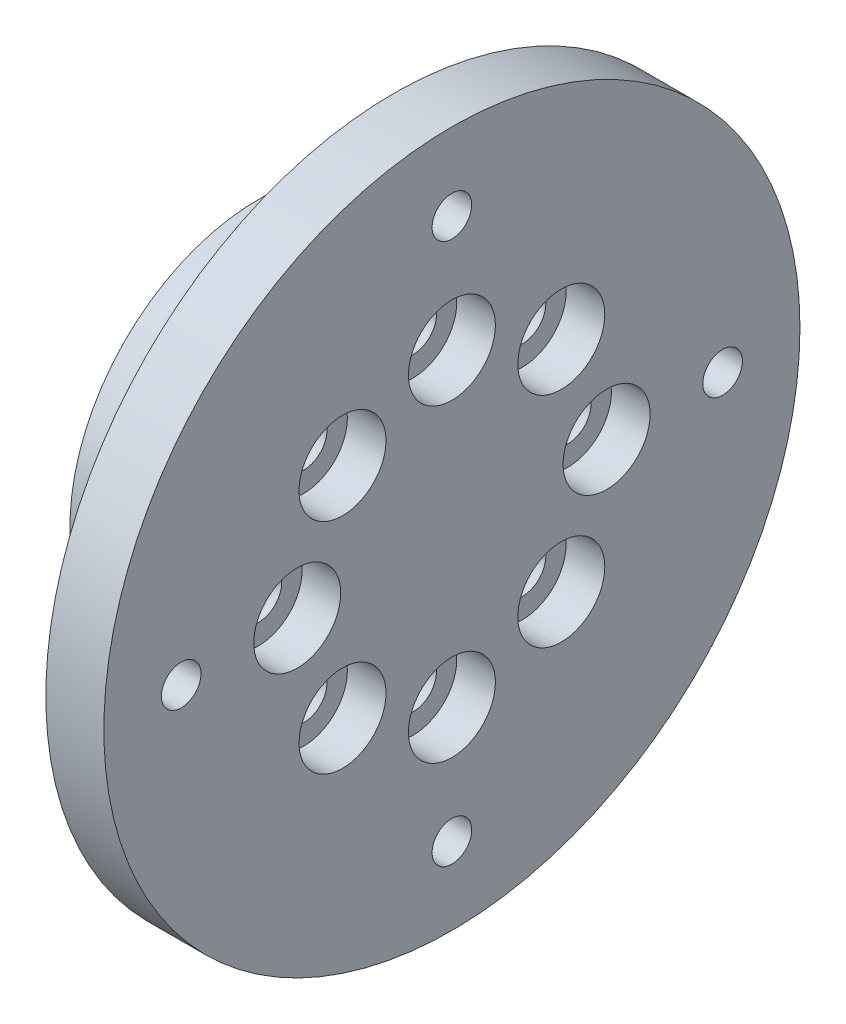
from build123d import *

# Parameters (mm, degrees)
SKETCH1_R                                       = 9.75
BOSS_EXTRUDE1_DEPTH                             = 10
SKETCH6_R                                       = 18
BOSS_EXTRUDE2_DEPTH                             = 3
CBORE_FOR_M2_SOCKET_HEAD_CAP_SCREW5_D           = 2.4
CBORE_FOR_M2_SOCKET_HEAD_CAP_SCREW5_CBORE_D     = 4.5
CBORE_FOR_M2_SOCKET_HEAD_CAP_SCREW5_CBORE_DEPTH = 2
SKETCH14_R                                      = 4
CUT_EXTRUDE1_DEPTH                              = 2.2
M2_5_TAPPED_HOLE1_D                             = 2.05
SKETCH16_R                                      = 2.5
CUT_EXTRUDE2_DEPTH                              = 3


with BuildPart() as part:
    # Sketch1 → Boss-Extrude1 (new body)
    with BuildSketch(Plane(origin=(0, 0, 0), x_dir=(0, 0, -1), z_dir=(1, 0, 0))):
        Circle(SKETCH1_R)
    extrude(amount=BOSS_EXTRUDE1_DEPTH)

    # Sketch6 → Boss-Extrude2 (add)
    with BuildSketch(Plane(origin=(7, 0, 0), x_dir=(0, 0, -1), z_dir=(1, 0, 0))):
        Circle(SKETCH6_R)
    extrude(amount=BOSS_EXTRUDE2_DEPTH)

    # CBORE for M2 Socket Head Cap Screw5 (through all)
    with Locations(Plane(origin=(10, 8, 0), x_dir=(0, 0, 1), z_dir=(1, 0, 0))):
        with Locations((0, 0), (-5.656854249, 2.343145751), (-8, 8), (-5.656854249, 13.656854249), (0, 16), (5.656854249, 13.656854249), (8, 8), (5.656854249, 2.343145751)):
            CounterBoreHole(CBORE_FOR_M2_SOCKET_HEAD_CAP_SCREW5_D / 2, CBORE_FOR_M2_SOCKET_HEAD_CAP_SCREW5_CBORE_D / 2, CBORE_FOR_M2_SOCKET_HEAD_CAP_SCREW5_CBORE_DEPTH)

    # Sketch14 → Cut-Extrude1 (cut)
    with BuildSketch(Plane.ZY):
        Circle(SKETCH14_R)
    extrude(amount=-CUT_EXTRUDE1_DEPTH, mode=Mode.SUBTRACT)

    # M2.5 Tapped Hole1 (through all)
    with Locations(Plane(origin=(10, 14, 0), x_dir=(0, 0, 1), z_dir=(1, 0, 0))):
        with Locations((0, 0), (-14, 14), (0, 28), (14, 14)):
            Hole(M2_5_TAPPED_HOLE1_D / 2)

    # Sketch16 → Cut-Extrude2 (cut)
    with BuildSketch(Plane(origin=(2.2, 0, 0), x_dir=(0, 0, -1), z_dir=(1, 0, 0))):
        Circle(SKETCH16_R)
    extrude(amount=CUT_EXTRUDE2_DEPTH, mode=Mode.SUBTRACT)


solid = part.part
